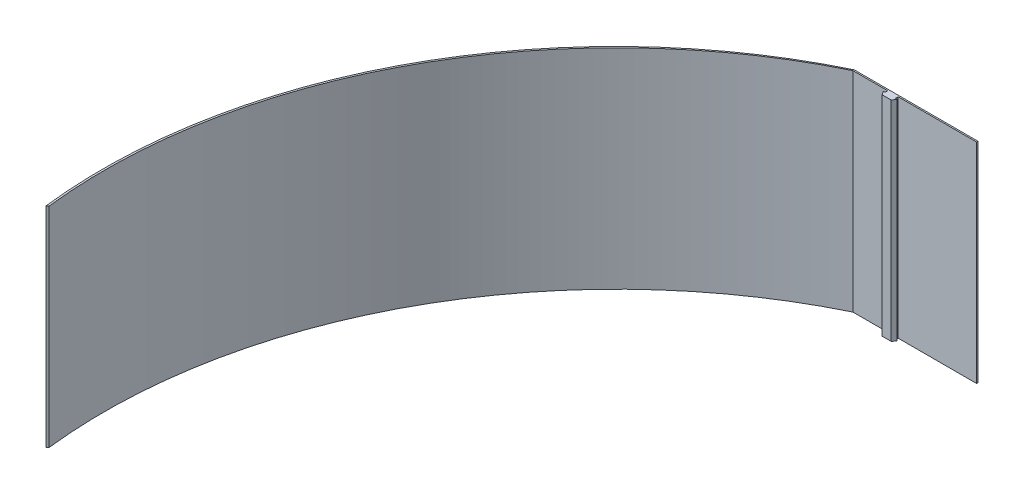
from build123d import *

# Parameters (mm, degrees)
BOSS_EXTRUDE1_DEPTH = 120


with BuildPart() as part:
    # Sketch1 → Boss-Extrude1 (new body)
    with BuildSketch(Plane(origin=(0, 0, 0), x_dir=(1, 0, 0), z_dir=(0, 1, 0))):
        with BuildLine():
            Line((-3, 0), (-3, -1.6))
            Line((-3, -1.6), (-4, -1.6))
            Line((-4, -1.6), (-2.599584924, -3.6))
            Line((-2.599584924, -3.6), (2.599584924, -3.6))
            Line((2.599584924, -3.6), (4, -1.6))
            Line((4, -1.6), (3, -1.6))
            Line((3, -1.6), (3, 0))
            Line((3, 0), (48, 0))
            Line((48, 0), (48, 0.8))
            Line((48, 0.8), (-23, 0.8))
            ThreePointArc((-23, 0.8), (-153.089844763, -122.665428697), (-187.317261189, -298.720998783))
            Line((-187.317261189, -298.720998783), (-186.319141297, -297.948173118))
            ThreePointArc((-186.319141297, -297.948173118), (-152.080290875, -122.980601765), (-23, 0))
            Line((-23, 0), (-3, 0))
        make_face()
    extrude(amount=BOSS_EXTRUDE1_DEPTH)


solid = part.part
